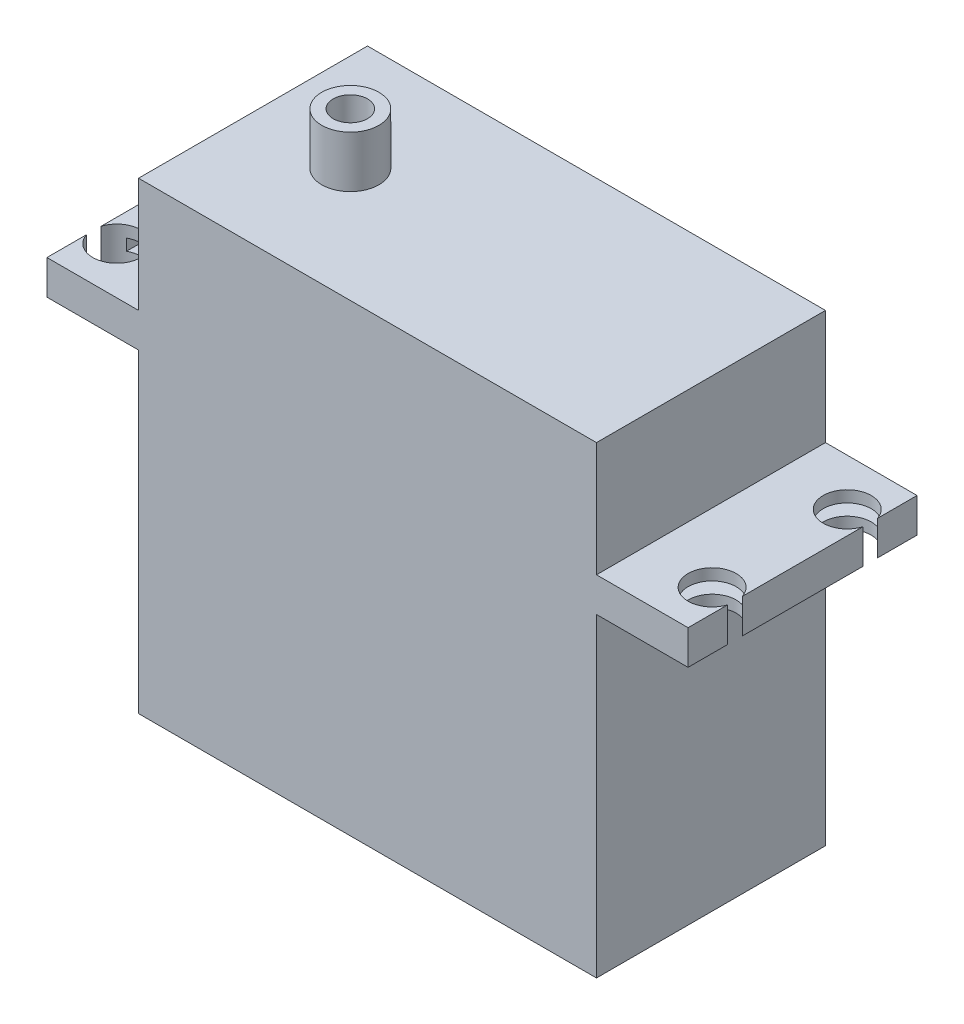
from build123d import *

# Parameters (mm, degrees)
BOSS_EXTRUDE1_DEPTH      = 10
BOSS_EXTRUDE1_DEPTH_BACK = 10
SKETCH1_W                = 40
SKETCH1_H                = 40.5
SKETCH2_W                = 20
SKETCH2_H                = 3
BOSS_EXTRUDE2_DEPTH      = 8
SKETCH3_W                = 20
SKETCH3_H                = 3
BOSS_EXTRUDE3_DEPTH      = 8
SKETCH4_R                = 2.5
BOSS_EXTRUDE4_DEPTH      = 4.5
SHELL1_T                 = -1
SKETCH5_R                = 2.1
CUT_EXTRUDE1_DEPTH       = 10
SKETCH6_R                = 2.1
CUT_EXTRUDE2_DEPTH       = 10


with BuildPart() as part:
    # Sketch1 → Boss-Extrude1 (new, two sides: drawn at the far end of the back side and taken through both)
    with BuildSketch(Plane.XY.offset(-BOSS_EXTRUDE1_DEPTH_BACK)):
        with Locations((20, 20.25)):
            Rectangle(SKETCH1_W, SKETCH1_H)
    extrude(amount=BOSS_EXTRUDE1_DEPTH + BOSS_EXTRUDE1_DEPTH_BACK)

    # Sketch2 → Boss-Extrude2 (add)
    with BuildSketch(Plane(origin=(40, 0, 0), x_dir=(0, 0, -1), z_dir=(1, 0, 0))):
        with Locations((0, 29)):
            Rectangle(SKETCH2_W, SKETCH2_H)
    extrude(amount=BOSS_EXTRUDE2_DEPTH)

    # Sketch3 → Boss-Extrude3 (add)
    with BuildSketch(Plane.ZY):
        with Locations((0, 29)):
            Rectangle(SKETCH3_W, SKETCH3_H)
    extrude(amount=BOSS_EXTRUDE3_DEPTH)

    # Sketch4 → Boss-Extrude4 (add)
    with BuildSketch(Plane(origin=(0, 40.5, 0), x_dir=(1, 0, 0), z_dir=(0, 1, 0))):
        with Locations((8.5, 0)):
            Circle(SKETCH4_R)
    extrude(amount=BOSS_EXTRUDE4_DEPTH)

    # Shell1
    shell1_openings = [part.faces().sort_by_distance(p)[0] for p in [
        (8.5, 45, 0),
    ]]
    offset(amount=SHELL1_T, openings=shell1_openings, kind=Kind.INTERSECTION)

    # Sketch5 → Cut-Extrude1 (cut)
    with BuildSketch(Plane(origin=(0, 30.5, 0), x_dir=(1, 0, 0), z_dir=(0, 1, 0))):
        with Locations((-6, 5.9)):
            Circle(SKETCH5_R)
        with Locations((-6, -5.9)):
            Circle(SKETCH5_R)
    extrude(amount=-CUT_EXTRUDE1_DEPTH, mode=Mode.SUBTRACT)

    # Sketch6 → Cut-Extrude2 (cut)
    with BuildSketch(Plane(origin=(0, 30.5, 0), x_dir=(1, 0, 0), z_dir=(0, 1, 0))):
        with Locations((46, 5.9)):
            Circle(SKETCH6_R)
        with Locations((46, -5.9)):
            Circle(SKETCH6_R)
    extrude(amount=-CUT_EXTRUDE2_DEPTH, mode=Mode.SUBTRACT)


solid = part.part
